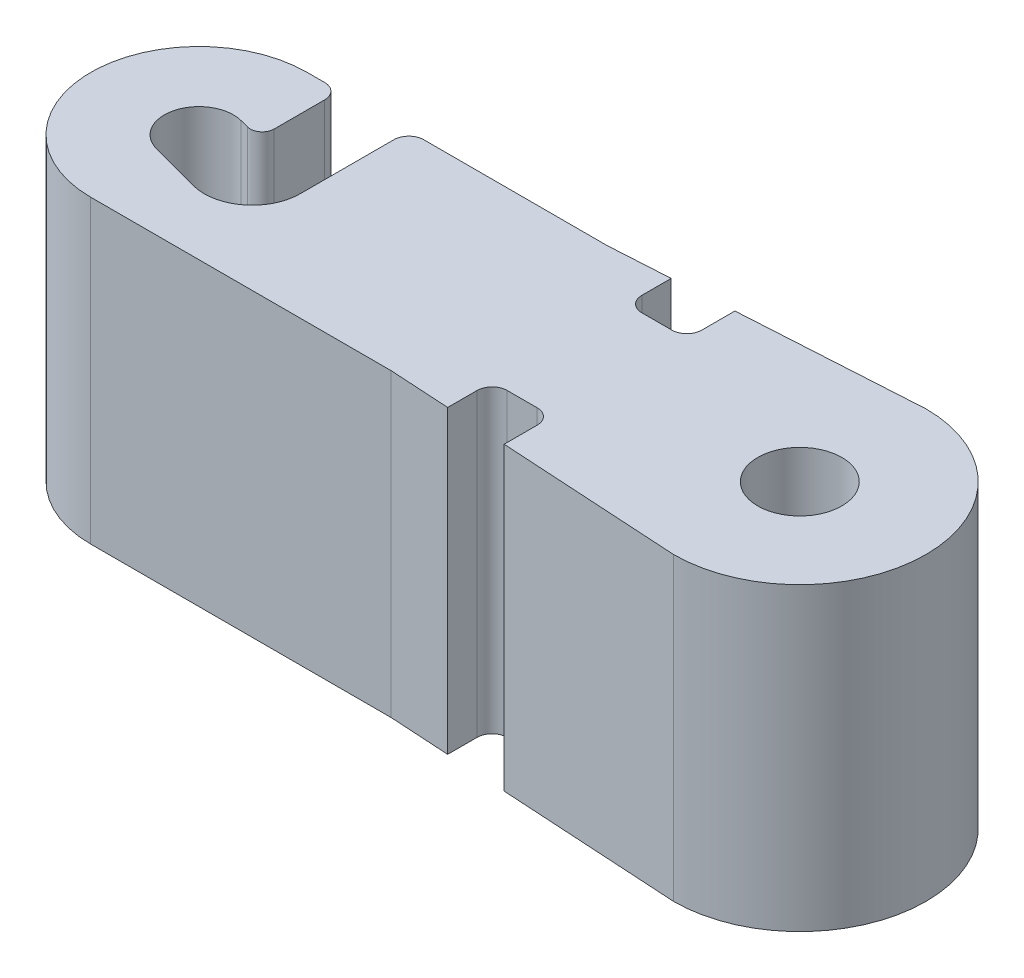
from build123d import *

# Parameters (mm, degrees)
BOSS_EXTRUDE1_DEPTH = 2.5
SKETCH4_R           = 0.35
THROUGH_HOLES_DEPTH = 7.493265742
FILLET1_R           = 0.125
FILLET2_R           = 0.4
FILLET3_R           = 0.1


with BuildPart() as part:
    # Sketch3 → Boss-Extrude1 (new body)
    with BuildSketch(Plane(origin=(0, 0, 0), x_dir=(1, 0, 0), z_dir=(0, 1, 0))):
        with BuildLine():
            Line((-2.5, 0.9), (-2, 0.93))
            Line((-2, 0.93), (-2, 0.56))
            Line((-2, 0.56), (-1.5, 0.56))
            Line((-1.5, 0.56), (-1.5, 0.96))
            Line((-1.5, 0.96), (0, 1.05))
            ThreePointArc((0, 1.05), (1.05, 0), (0, -1.05))
            Line((0, -1.05), (-1.5, -0.96))
            Line((-1.5, -0.96), (-1.5, -0.56))
            Line((-1.5, -0.56), (-2, -0.56))
            Line((-2, -0.56), (-2, -0.93))
            Line((-2, -0.93), (-2.5, -0.9))
            Line((-2.5, -0.9), (-5, -0.9))
            ThreePointArc((-5, -0.9), (-5.9, 0), (-5, 0.9))
            Line((-5, 0.9), (-2.5, 0.9))
        make_face()
    extrude(amount=BOSS_EXTRUDE1_DEPTH)

    # Sketch4 → Through Holes (cut, through all)
    with BuildSketch(Plane(origin=(0, 2.5, 0), x_dir=(1, 0, 0), z_dir=(0, 1, 0))):
        with Locations(Location((0, 0, 0), (0, 0, 270))):
            Circle(SKETCH4_R)
        with BuildLine():
            Line((-4.925589525, 0.277703675), (-4.728379147, 0.224861314))
            Line((-4.728379147, 0.224861314), (-4.728379147, 0.9))
            Line((-4.728379147, 0.9), (-4.153379147, 0.9))
            Line((-4.153379147, 0.9), (-4.153379147, -0.524493276))
            Line((-4.153379147, -0.524493276), (-5.074410475, -0.277703675))
            ThreePointArc((-5.074410475, -0.277703675), (-5.277703675, 0.074410475), (-4.925589525, 0.277703675))
        make_face()
    extrude(amount=-THROUGH_HOLES_DEPTH, mode=Mode.SUBTRACT)

    # Fillet1
    fillet1_edges = [part.edges().sort_by_distance(p)[0] for p in [
        (-2, 1.25, 0.56),
        (-1.5, 1.25, 0.56),
        (-1.5, 1.25, -0.56),
        (-2, 1.25, -0.56),
        (-4.728379147, 1.25, -0.9),
        (-4.153379147, 1.25, -0.9),
    ]]
    fillet(fillet1_edges, radius=FILLET1_R)

    # Fillet2
    fillet2_edges = [part.edges().sort_by_distance(p)[0] for p in [
        (-4.153379147, 1.25, 0.524493276),
    ]]
    fillet(fillet2_edges, radius=FILLET2_R)

    # Fillet3
    fillet3_edges = [part.edges().sort_by_distance(p)[0] for p in [
        (-4.728379147, 1.25, -0.224861314),
    ]]
    fillet(fillet3_edges, radius=FILLET3_R)


solid = part.part
